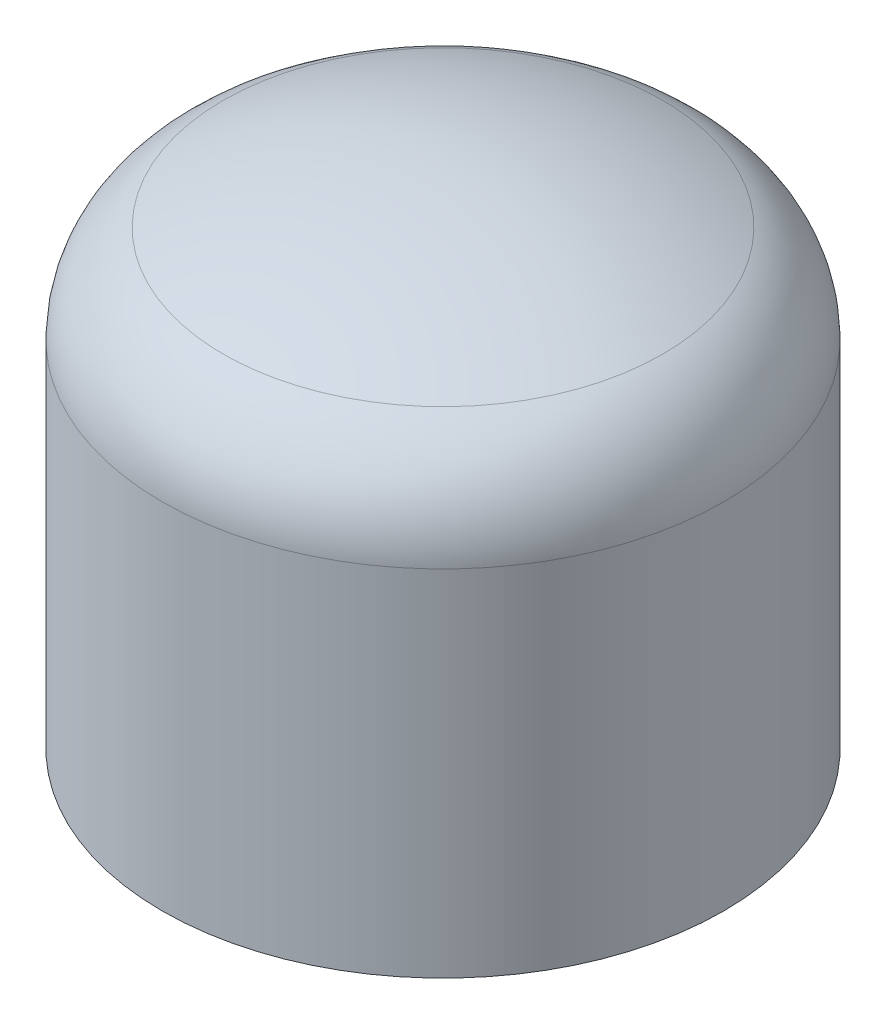
from build123d import *
from build123d.topology import SkipClean

# Parameters (mm, degrees)
EXTRUDE_START       = -30
SKETCH_2_R          = 55
SKETCH_2_R_2        = 45
SKETCH_2_R_3        = 2.25
EXTRUDE_1_DEPTH     = 2
CUT_EXTRUDE_1_REACH = 110.083


with BuildPart() as part:
    # 草图1 → 旋转1 (revolve)
    with BuildSketch(Plane.XY, mode=Mode.PRIVATE) as revolve_1_sk:
        with BuildLine():
            Line((-55, 71.937473), (-55, 0))
            Line((-55, 0), (-57, 0))
            Line((-57, 0), (-57, 71.937473))
            ThreePointArc((-57, 71.937473), (-53.651407, 83.604735), (-44.625, 91.720278))
            ThreePointArc((-44.625, 91.720278), (-22.896852, 99.396852), (0, 102))
            Line((0, 102), (0, 100))
            ThreePointArc((0, 100), (-22.447894, 97.447894), (-43.75, 89.921841))
            ThreePointArc((-43.75, 89.921841), (-51.955825, 82.544075), (-55, 71.937473))
        make_face()
    revolve(revolve_1_sk.sketch.rotate(Axis((0, -83.899931, 0), (0, 1, 0)), 180), axis=Axis((0, -83.899931, 0), (0, 1, 0)))

    # 草图2 → 凸台-拉伸1 (add)
    with BuildSketch(Plane.XZ.offset(EXTRUDE_START)):
        Circle(SKETCH_2_R)
        Circle(SKETCH_2_R_2, mode=Mode.SUBTRACT)
        with Locations((0, 50)):
            Circle(SKETCH_2_R_3, mode=Mode.SUBTRACT)
        with Locations((43.30127, -25)):
            Circle(SKETCH_2_R_3, mode=Mode.SUBTRACT)
        with Locations((-43.30127, -25)):
            Circle(SKETCH_2_R_3, mode=Mode.SUBTRACT)
    extrude(amount=-EXTRUDE_1_DEPTH)

    # 草图3 → 切除-拉伸1 (cut, up to next)
    with BuildSketch(Plane.XZ.offset(-30), mode=Mode.PRIVATE) as cut_extrude_1_sk1:
        with BuildLine():
            Line((0, 0), (-4.793566, 54.790708))
            ThreePointArc((-4.793566, 54.790708), (-40.550254, 37.157461), (-55, 0))
            Line((-55, 0), (0, 0))
        make_face()
    cut_extrude_1_tool1 = extrude(cut_extrude_1_sk1.sketch, amount=-CUT_EXTRUDE_1_REACH, mode=Mode.PRIVATE) & part.part
    add(cut_extrude_1_tool1.solids().sort_by_distance((-24.621775, 30, 22.5617))[0], mode=Mode.SUBTRACT)


solid = part.part
